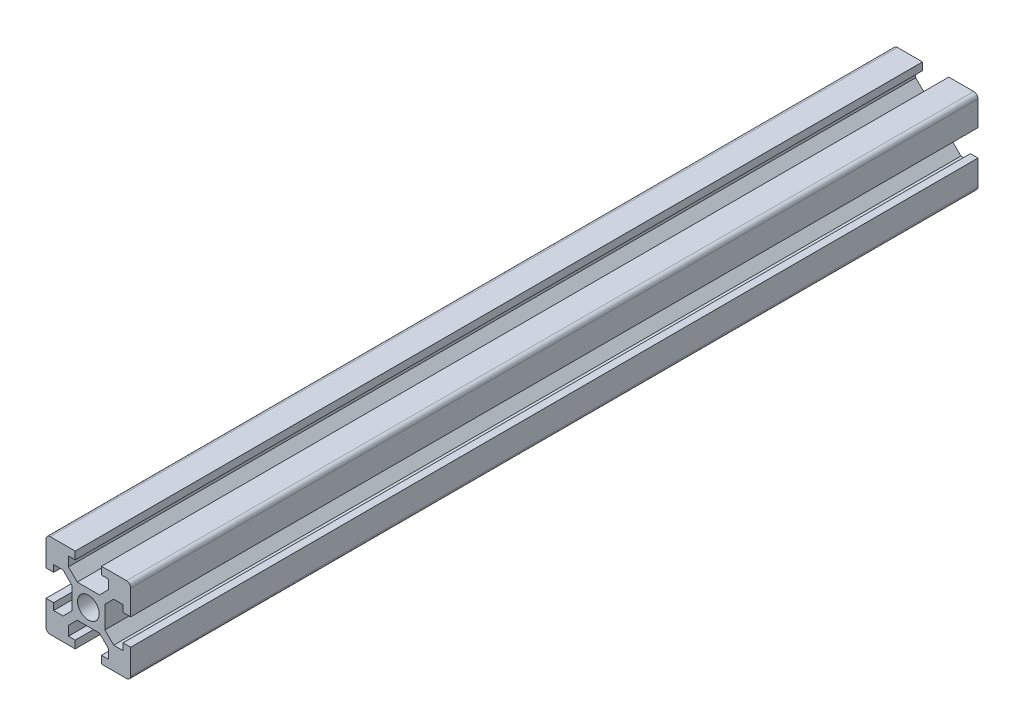
from build123d import *

# Parameters (mm, degrees)
SKETCH_1_R      = 2.55
EXTRUDE_1_DEPTH = 200
FILLET_1_R      = 1


with BuildPart() as part:
    # 草图1 → 凸台-拉伸1 (new body)
    with BuildSketch(Plane.XY):
        Polygon((4.62194142, 1.905266374), (6.694733626, 3.97805858), (6.694733626, 6.205266374), (5.094733626, 6.205266374), (5.094733626, 8.005266374), (11.994733626, 8.005266374), (11.994733626, 1.105266374), (10.194733626, 1.105266374), (10.194733626, 2.705266374), (7.967525833, 2.705266374), (5.894733626, 0.632474167), (5.894733626, -4.62194142), (7.967525833, -6.694733626), (10.194733626, -6.694733626), (10.194733626, -5.094733626), (11.994733626, -5.094733626), (11.994733626, -11.994733626), (5.094733626, -11.994733626), (5.094733626, -10.194733626), (6.694733626, -10.194733626), (6.694733626, -7.967525833), (4.62194142, -5.894733626), (-0.632474167, -5.894733626), (-2.705266374, -7.967525833), (-2.705266374, -10.194733626), (-1.105266374, -10.194733626), (-1.105266374, -11.994733626), (-8.005266374, -11.994733626), (-8.005266374, -5.094733626), (-6.205266374, -5.094733626), (-6.205266374, -6.694733626), (-3.97805858, -6.694733626), (-1.905266374, -4.62194142), (-1.905266374, 0.632474167), (-3.97805858, 2.705266374), (-6.205266374, 2.705266374), (-6.205266374, 1.105266374), (-8.005266374, 1.105266374), (-8.005266374, 8.005266374), (-1.105266374, 8.005266374), (-1.105266374, 6.205266374), (-2.705266374, 6.205266374), (-2.705266374, 3.97805858), (-0.632474167, 1.905266374), align=None)
        with Locations((1.994733626, -1.994733626)):
            Circle(SKETCH_1_R, mode=Mode.SUBTRACT)
    extrude(amount=EXTRUDE_1_DEPTH)

    # 圆角1
    fillet_1_edges = [part.edges().sort_by_distance(p)[0] for p in [
        (-8.005266374, -11.994733626, 100),
        (-8.005266374, 8.005266374, 100),
        (11.994733626, 8.005266374, 100),
        (11.994733626, -11.994733626, 100),
    ]]
    fillet(fillet_1_edges, radius=FILLET_1_R)


solid = part.part
